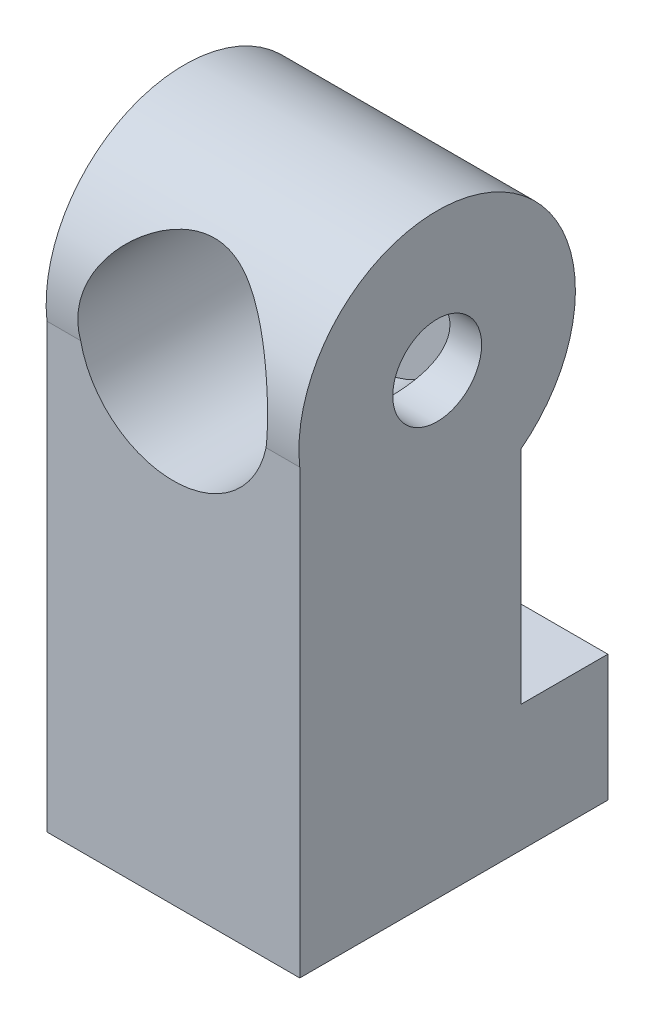
from build123d import *

# Parameters (mm, degrees)
BOSS_EXTRUDE1_DEPTH = 6.4
SKETCH2_R           = 1.125
CUT_EXTRUDE1_DEPTH  = 2
SKETCH4_R           = 2.4
CUT_EXTRUDE3_DEPTH  = 5
SKETCH5_W           = 4.8
SKETCH5_H           = 3.3
CUT_EXTRUDE4_DEPTH  = 8.9


with BuildPart() as part:
    # Sketch1 → Boss-Extrude1 (new body)
    with BuildSketch(Plane(origin=(0, 0, 0), x_dir=(0, 0, -1), z_dir=(1, 0, 0))):
        with BuildLine():
            Line((0, 0), (7.8, 0))
            Line((7.8, 0), (7.8, 3.2))
            Line((7.8, 3.2), (5.6, 3.2))
            Line((5.6, 3.2), (5.6, 8.8))
            ThreePointArc((5.6, 8.8), (4.857585772, 14.801033467), (0, 11.2))
            Line((0, 11.2), (0, 0))
        make_face()
    extrude(amount=BOSS_EXTRUDE1_DEPTH)

    # Sketch2 → Cut-Extrude1 (cut)
    with BuildSketch(Plane(origin=(6.4, 0, 0), x_dir=(0, 0, -1), z_dir=(1, 0, 0))):
        with Locations((3.478868227, 11.584025862)):
            Circle(SKETCH2_R)
    extrude(amount=-CUT_EXTRUDE1_DEPTH, mode=Mode.SUBTRACT)

    # Sketch4 → Cut-Extrude3 (cut, symmetric)
    with BuildSketch(Plane.XY):
        with Locations((3.2, 11.7)):
            Circle(SKETCH4_R)
    extrude(amount=CUT_EXTRUDE3_DEPTH, both=True, mode=Mode.SUBTRACT)

    # Sketch5 → Cut-Extrude4 (cut)
    with BuildSketch(Plane.XZ):
        with Locations((3.2, -3.05)):
            Rectangle(SKETCH5_W, SKETCH5_H)
    extrude(amount=-CUT_EXTRUDE4_DEPTH, mode=Mode.SUBTRACT)


solid = part.part
